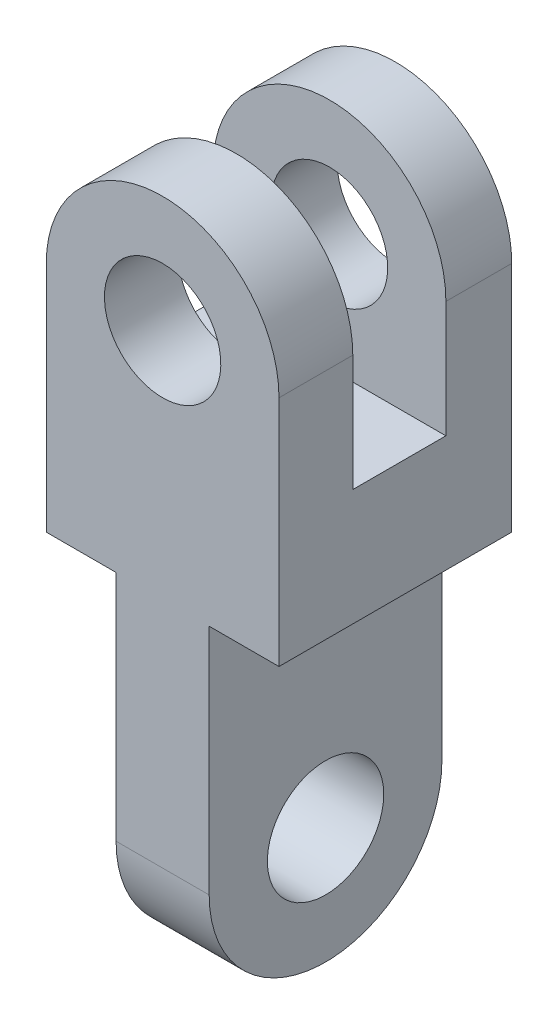
from build123d import *

# Parameters (mm, degrees)
SKETCH2_R               = 25
BOSS_EXTRUDE1_DEPTH     = 20
SKETCH3_R               = 25
BOSS_EXTRUDE2_DEPTH     = 100
CUT_EXTRUDE1_DEPTH      = 188.082869339
CUT_EXTRUDE1_DEPTH_BACK = 188.082869339
SKETCH4_W               = 40
SKETCH4_H               = 100


with BuildPart() as part:
    # Sketch2 → Boss-Extrude1 (new, symmetric)
    with BuildSketch(Plane(origin=(0, 0, 0), x_dir=(0, 0, -1), z_dir=(1, 0, 0))):
        with BuildLine():
            Line((-50, 0), (50, 0))
            Line((50, 0), (50, -100))
            ThreePointArc((50, -100), (0, -150), (-50, -100))
            Line((-50, -100), (-50, 0))
        make_face()
        with Locations((0, -100)):
            Circle(SKETCH2_R, mode=Mode.SUBTRACT)
    extrude(amount=BOSS_EXTRUDE1_DEPTH, both=True)

    # Sketch3 → Boss-Extrude2 (add)
    with BuildSketch(Plane(origin=(0, 0, -50), x_dir=(-1, 0, 0), z_dir=(0, 0, -1))):
        with BuildLine():
            Line((-50, 0), (50, 0))
            Line((50, 0), (50, 100))
            ThreePointArc((50, 100), (0, 150), (-50, 100))
            Line((-50, 100), (-50, 0))
        make_face()
        with Locations(Location((0, 100, 0), (0, 0, 90))):
            Circle(SKETCH3_R, mode=Mode.SUBTRACT)
    extrude(amount=-BOSS_EXTRUDE2_DEPTH)

    # Sketch4 → Cut-Extrude1 (cut, two sides: drawn at the far end of the back side and taken through both)
    with BuildSketch(Plane(origin=(50, 0, 0), x_dir=(0, 0, -1), z_dir=(1, 0, 0)).offset(-CUT_EXTRUDE1_DEPTH_BACK)):
        with Locations((1.706579079, 100)):
            Rectangle(SKETCH4_W, SKETCH4_H)
    extrude(amount=CUT_EXTRUDE1_DEPTH + CUT_EXTRUDE1_DEPTH_BACK, mode=Mode.SUBTRACT)


solid = part.part
